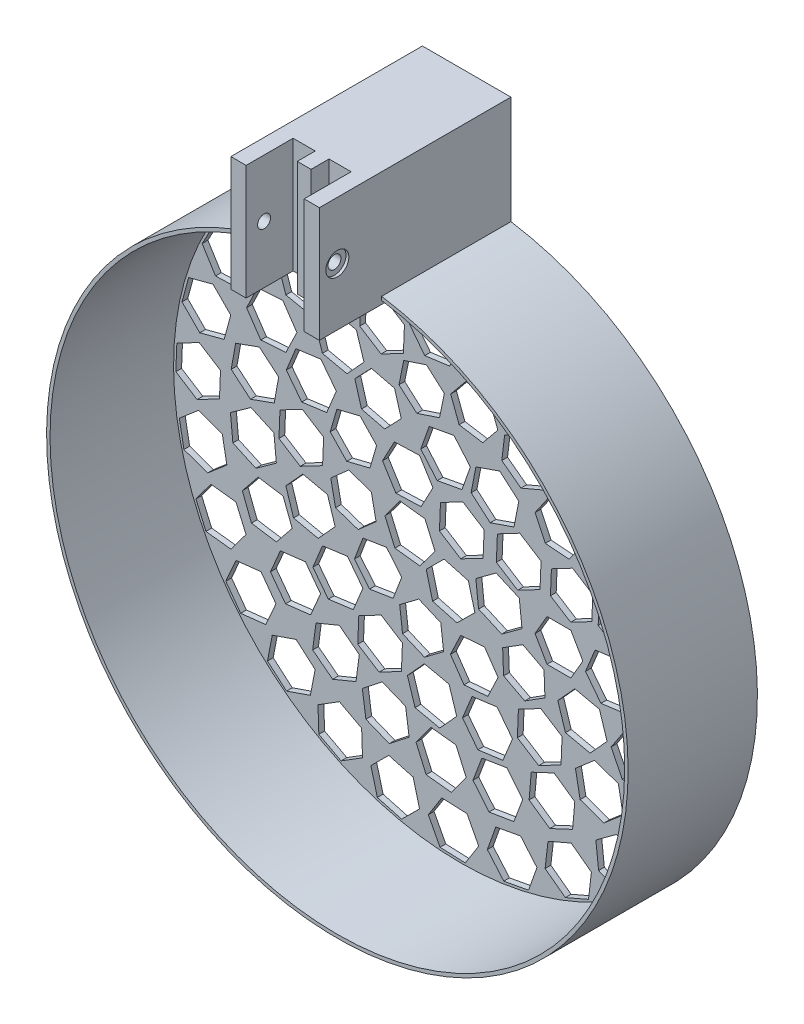
from build123d import *

# Parameters (mm, degrees)
BOSS_EXTRU_1_DEPTH                                = 20
CHAMBRAGE_POUR_VIS_SIX_PANS_CREUX_M41_D           = 4.5
CHAMBRAGE_POUR_VIS_SIX_PANS_CREUX_M41_DEPTH       = 11.55
CHAMBRAGE_POUR_VIS_SIX_PANS_CREUX_M41_CBORE_D     = 8
CHAMBRAGE_POUR_VIS_SIX_PANS_CREUX_M41_CBORE_DEPTH = 1
ESQUISSE6_W                                       = 20.2
ESQUISSE6_H                                       = 40
ENL_V_MAT_EXTRU_1_DEPTH                           = 3
ESQUISSE16_R                                      = 101.2
ESQUISSE16_R_2                                    = 100
EXTRU_MINCE1_DEPTH                                = 45
ESQUISSE14_W                                      = 30.8
ESQUISSE14_H                                      = 45
BOSS_EXTRU_3_DEPTH                                = 40
BOSS_EXTRU_4_START                                = -2
ESQUISSE17_R                                      = 100
BOSS_EXTRU_4_DEPTH                                = 2
ENL_V_MAT_EXTRU_2_DEPTH                           = 2


with BuildPart() as part:
    # Base → Boss.-Extru.1 (new, symmetric)
    with BuildSketch(Plane(origin=(0, 0, 0), x_dir=(1, 0, 0), z_dir=(0, 1, 0))):
        Polygon((-3.85, -2.4), (-3.85, 2.4), (-10.1, 2.4), (-10.1, 10.1), (-2.4, 10.1), (-2.4, 3.85), (2.4, 3.85), (2.4, 10.1), (10.1, 10.1), (10.1, 2.4), (3.85, 2.4), (3.85, -2.4), (10.1, -2.4), (10.1, -6.25), (15.4, -6.25), (15.4, 15.4), (-15.4, 15.4), (-15.4, -6.25), (-10.1, -6.25), (-10.1, -2.4), align=None)
    extrude(amount=BOSS_EXTRU_1_DEPTH, both=True)

    # Chambrage pour vis à six pans creux M41
    with Locations(Plane(origin=(15.4, 0, 0), x_dir=(0, 0, -1), z_dir=(1, 0, 0))):
        with Locations((0, 0)):
            chambrage_pour_vis_six_pans_creux_m41 = CounterBoreHole(CHAMBRAGE_POUR_VIS_SIX_PANS_CREUX_M41_D / 2, CHAMBRAGE_POUR_VIS_SIX_PANS_CREUX_M41_CBORE_D / 2, CHAMBRAGE_POUR_VIS_SIX_PANS_CREUX_M41_CBORE_DEPTH, depth=CHAMBRAGE_POUR_VIS_SIX_PANS_CREUX_M41_DEPTH)

    # Symétrie1: Chambrage pour vis à six pans creux M41 across plane
    add(chambrage_pour_vis_six_pans_creux_m41.mirror(Plane(origin=(0, 0, 0), x_dir=(0, 0, 1), z_dir=(1, 0, 0))), mode=Mode.SUBTRACT)

    # Esquisse6 → Enlèv. mat.-Extru.1 (cut, symmetric)
    with BuildSketch(Plane.XY):
        Rectangle(ESQUISSE6_W, ESQUISSE6_H)
    extrude(amount=ENL_V_MAT_EXTRU_1_DEPTH, both=True, mode=Mode.SUBTRACT)

    # Esquisse16 → Extru.-Mince1 (add)
    with BuildSketch(Plane(origin=(0, 0, -15.4), x_dir=(-1, 0, 0), z_dir=(0, 0, -1))):
        with Locations((0, -117.566500624)):
            Circle(ESQUISSE16_R)
        with Locations((0, -117.566500624)):
            Circle(ESQUISSE16_R_2, mode=Mode.SUBTRACT)
    extrude(amount=EXTRU_MINCE1_DEPTH)

    # Esquisse14 → Boss.-Extru.3 (add)
    with BuildSketch(Plane.XZ.offset(20)):
        with Locations((0, -37.9)):
            Rectangle(ESQUISSE14_W, ESQUISSE14_H)
    extrude(amount=-BOSS_EXTRU_3_DEPTH)

    # Esquisse17 → Boss.-Extru.4 (add)
    with BuildSketch(Plane(origin=(0, 0, -60.4), x_dir=(-1, 0, 0), z_dir=(0, 0, -1)).offset(BOSS_EXTRU_4_START)):
        with Locations((0, -117.566500624)):
            Circle(ESQUISSE17_R)
    extrude(amount=BOSS_EXTRU_4_DEPTH)

    # Esquisse18 → Enlèv. mat.-Extru.2 (cut)
    with BuildSketch(Plane(origin=(0, 0, -60.4), x_dir=(-1, 0, 0), z_dir=(0, 0, -1))):
        Polygon((-29.387612526, -106.502992287), (-25.826513123, -98.986886987), (-30.55510155, -92.144831789), (-38.844789378, -92.818881891), (-42.405888781, -100.334987191), (-37.677300355, -107.177042389), align=None)
        Polygon((-31.162907279, -121.427355014), (-31.502618651, -113.117248876), (-38.869237361, -109.256394486), (-45.896144698, -113.705646234), (-45.556433326, -122.015752371), (-38.189814616, -125.876606761), align=None)
        Polygon((-20.879969902, -94.11314599), (-14.233864682, -89.112890673), (-15.241160202, -80.857067057), (-22.894560942, -77.601498759), (-29.540666163, -82.601754076), (-28.533370643, -90.857577692), align=None)
        Polygon((-7.588977805, -87.096180597), (0.619590621, -85.757273496), (3.564347272, -77.978991159), (-1.699464504, -71.539615923), (-9.90803293, -72.878523024), (-12.852789581, -80.656805361), align=None)
        Polygon((7.44055765, -87.059598314), (15.33110518, -89.688766911), (21.553305741, -84.169936598), (19.884958772, -76.021937689), (11.994411242, -73.392769092), (5.772210681, -78.911599404), align=None)
        Polygon((20.765551016, -94.011779702), (26.530448302, -100.006713156), (34.604661611, -98.011632383), (36.913977633, -90.021618156), (31.149080346, -84.026684702), (23.074867038, -86.021765475), align=None)
        Polygon((29.333406896, -106.360063789), (31.651985445, -114.347395092), (39.728506536, -116.333112821), (45.486449079, -110.331499245), (43.167870531, -102.344167942), (35.09134944, -100.358450213), align=None)
        Polygon((31.181332763, -121.275607502), (29.52243417, -129.425535311), (35.751029395, -134.93714754), (43.638523213, -132.298831959), (45.297421806, -124.148904149), (39.068826581, -118.637291921), align=None)
        Polygon((25.885991069, -135.341439529), (20.62964901, -141.7869136), (23.583422266, -149.561776389), (31.79353758, -150.891165107), (37.049879639, -144.445691036), (34.096106383, -136.670828247), align=None)
        Polygon((14.660480781, -145.335247264), (7.010859877, -148.599687163), (6.013137307, -156.856673146), (12.665035641, -161.849219228), (20.314656545, -158.584779329), (21.312379115, -150.327793346), align=None)
        Polygon((0.076431024, -148.967569793), (-8.214032765, -148.303131681), (-12.934684943, -155.150664875), (-9.364873333, -162.662636182), (-1.074409544, -163.327074294), (3.646242634, -156.479541099), align=None)
        Polygon((-14.525128159, -145.4062858), (-21.557189489, -140.96518444), (-28.919326753, -144.834577513), (-29.249402686, -153.145071946), (-22.217341355, -157.586173305), (-14.855204092, -153.716780232), align=None)
        Polygon((-25.799155528, -135.467242528), (-29.961853894, -128.266880721), (-38.278899319, -128.271702352), (-42.433246376, -135.476885789), (-38.27054801, -142.677247595), (-29.953502586, -142.672425965), align=None)
        Polygon((-47.779097213, -122.041699254), (-48.137655018, -113.2705669), (-55.912957359, -109.195520891), (-63.329701895, -113.891607235), (-62.97114409, -122.662739589), (-55.195841749, -126.737785599), align=None)
        Polygon((-46.428273156, -105.430398077), (-43.765303334, -97.065595736), (-49.677949748, -90.57699505), (-58.253565984, -92.453196706), (-60.916535805, -100.817999046), (-55.003889392, -107.306599732), align=None)
        Polygon((-39.477514148, -90.282889976), (-34.114210162, -83.333336262), (-37.45104823, -75.213801905), (-46.151190284, -74.043821261), (-51.51449427, -80.993374975), (-48.177656202, -89.112909332), align=None)
        Polygon((-27.765184308, -78.426187982), (-20.348439771, -73.730101638), (-20.706997576, -64.958969284), (-28.482299917, -60.883923275), (-35.899044453, -65.580009619), (-35.540486648, -74.351141973), align=None)
        Polygon((-12.703963469, -71.290385343), (-4.128347234, -69.414183688), (-1.465377412, -61.049381347), (-7.378023826, -54.560780662), (-15.953640061, -56.436982317), (-18.616609883, -64.801784658), align=None)
        Polygon((3.889542854, -69.736165169), (12.589684908, -70.906145813), (17.952988895, -63.956592099), (14.616150827, -55.837057742), (5.916008772, -54.667077098), (0.552704786, -61.616630812), align=None)
        Polygon((20.013912905, -73.950989352), (27.789215246, -78.026035361), (35.205959782, -73.329949017), (34.847401978, -64.558816663), (27.072099637, -60.483770653), (19.655355101, -65.179856998), align=None)
        Polygon((33.724309687, -83.42648789), (39.636956101, -89.915088576), (48.212572336, -88.03888692), (50.875542158, -79.67408458), (44.962895744, -73.185483894), (36.387279508, -75.061685549), align=None)
        Polygon((43.367057002, -97.019775817), (46.70389507, -105.139310174), (55.404037124, -106.309290818), (60.76734111, -99.359737104), (57.430503043, -91.240202747), (48.730360988, -90.070222103), align=None)
        Polygon((47.779097213, -113.091301993), (48.137655018, -121.862434347), (55.912957359, -125.937480356), (63.329701895, -121.241394012), (62.97114409, -112.470261658), (55.195841749, -108.395215649), align=None)
        Polygon((46.428273156, -129.702603171), (43.765303334, -138.067405511), (49.677949748, -144.556006197), (58.253565984, -142.679804542), (60.916535805, -134.315002201), (55.003889392, -127.826401516), align=None)
        Polygon((39.477514148, -144.850111271), (34.114210162, -151.799664985), (37.45104823, -159.919199342), (46.151190284, -161.089179986), (51.51449427, -154.139626272), (48.177656202, -146.020091915), align=None)
        Polygon((27.765184308, -156.706813265), (20.348439771, -161.402899609), (20.706997576, -170.174031963), (28.482299917, -174.249077973), (35.899044453, -169.552991628), (35.540486648, -160.781859274), align=None)
        Polygon((12.703963469, -163.842615904), (4.128347234, -165.718817559), (1.465377412, -174.0836199), (7.378023826, -180.572220586), (15.953640061, -178.69601893), (18.616609883, -170.33121659), align=None)
        Polygon((-3.889542854, -165.396836078), (-12.589684908, -164.226855435), (-17.952988895, -171.176409148), (-14.616150827, -179.295943506), (-5.916008772, -180.465924149), (-0.552704786, -173.516370435), align=None)
        Polygon((-20.013912905, -161.182011895), (-27.789215246, -157.106965886), (-35.205959782, -161.80305223), (-34.847401978, -170.574184584), (-27.072099637, -174.649230594), (-19.655355101, -169.953144249), align=None)
        Polygon((-33.724309687, -151.706513357), (-39.636956101, -145.217912672), (-48.212572336, -147.094114327), (-50.875542158, -155.458916668), (-44.962895744, -161.947517353), (-36.387279508, -160.071315698), align=None)
        Polygon((-43.367057002, -138.11322543), (-46.70389507, -129.993691073), (-55.404037124, -128.823710429), (-60.76734111, -135.773264143), (-57.430503043, -143.8927985), (-48.730360988, -145.062779144), align=None)
        Polygon((-64.853002343, -123.592265661), (-65.211560148, -114.821133307), (-72.986862489, -110.746087297), (-80.403607025, -115.442173642), (-80.04504922, -124.213305996), (-72.269746879, -128.288352005), align=None)
        Polygon((-64.073809043, -105.871683316), (-62.052647364, -97.329070604), (-68.440186146, -91.307386889), (-76.848886609, -93.828315884), (-78.870048289, -102.370928596), (-72.482509506, -108.392612311), align=None)
        Polygon((-58.542554445, -89.01845207), (-54.291573596, -81.337925506), (-58.81761429, -73.816204818), (-67.594635833, -73.975010694), (-71.845616682, -81.655537257), (-67.319575988, -89.177257945), align=None)
        Polygon((-48.669466398, -74.282498986), (-42.503942183, -68.03368809), (-44.832809055, -59.569782043), (-53.327200143, -57.354686894), (-59.492724358, -63.60349779), (-57.163857486, -72.067403837), align=None)
        Polygon((-35.186786676, -62.756722293), (-27.56398782, -58.403072781), (-27.522959469, -49.624710568), (-35.104729973, -45.199997867), (-42.727528829, -49.553647379), (-42.768557181, -58.332009592), align=None)
        Polygon((-19.094463955, -55.295936121), (-10.579738578, -53.160338261), (-8.171857888, -44.718570849), (-14.278702576, -38.412401295), (-22.793427953, -40.547999155), (-25.201308643, -48.989766568), align=None)
        Polygon((-1.585992194, -52.453472849), (7.189161476, -52.694314165), (11.785313009, -45.215228823), (7.606310872, -37.495302165), (-1.168842798, -37.254460849), (-5.764994331, -44.733546191), align=None)
        Polygon((16.040105352, -54.440144975), (24.424874311, -57.039563368), (30.868421154, -51.077849642), (28.927199038, -42.516717523), (20.54243008, -39.917299129), (14.098883237, -45.879012855), align=None)
        Polygon((32.476581664, -61.108610115), (39.849105955, -65.873818615), (47.662159715, -61.871629539), (48.102689185, -53.104231963), (40.730164894, -48.339023463), (32.917111133, -52.341212539), align=None)
        Polygon((46.504418483, -71.964298717), (52.317911707, -78.541883608), (60.921013931, -76.796043237), (63.71062293, -68.472617975), (57.897129706, -61.895033083), (49.294027483, -63.640873454), align=None)
        Polygon((57.083235328, -86.202094018), (60.906537287, -94.10422592), (69.661635238, -94.744215247), (74.59343123, -87.482072673), (70.77012927, -79.579940771), (62.015031319, -78.939951444), align=None)
        Polygon((63.428449746, -102.766043874), (64.978003626, -111.406657813), (73.235771741, -114.385011759), (79.943985977, -108.722751765), (78.394432097, -100.082137826), (70.136663982, -97.103783881), align=None)
        Polygon((65.069466213, -120.4276759), (64.230348689, -129.165937069), (71.378346085, -134.261764745), (79.365461003, -130.619331253), (80.204578527, -121.881070084), (73.056581132, -116.785242408), align=None)
        Polygon((61.884578044, -137.877107645), (58.719022625, -146.064939187), (64.227115034, -152.900306367), (72.90076286, -151.547842006), (76.066318279, -143.360010463), (70.55822587, -136.524643283), align=None)
        Polygon((54.109993824, -153.820194581), (48.852775275, -160.850342488), (52.31245268, -168.918301259), (61.029348635, -169.956112122), (66.286567184, -162.925964215), (62.826889779, -154.858005445), align=None)
        Polygon((42.322318899, -167.074510887), (35.363341069, -172.425581249), (36.518015025, -181.127768016), (44.631666811, -184.47888442), (51.590644642, -179.127814058), (50.435970686, -170.425627291), align=None)
        Polygon((27.395791193, -176.657044555), (19.251169632, -179.932172964), (18.015203254, -188.623186344), (24.923858437, -194.039071316), (33.068479998, -190.763942908), (34.304446376, -182.072929527), align=None)
        Polygon((10.437442982, -181.857102901), (1.711227012, -182.813388065), (-1.823713728, -190.848655355), (3.367561501, -197.927637483), (12.093777472, -196.971352319), (15.628718212, -188.936085028), align=None)
        Polygon((-7.295002627, -182.289021386), (-15.955629487, -180.855540009), (-21.527374206, -187.639122193), (-18.438492065, -195.856185756), (-9.777865205, -197.289667133), (-4.206120486, -190.506084949), align=None)
        Polygon((-24.486411264, -177.920766592), (-32.439129939, -174.20383343), (-39.63444782, -179.232623251), (-38.877047026, -187.978346234), (-30.92432835, -191.695279397), (-23.729010469, -186.666489576), align=None)
        Polygon((-39.861774795, -169.076311994), (-46.516768523, -163.351594975), (-54.802015755, -166.252630096), (-56.432269259, -174.878382236), (-49.777275531, -180.603099255), (-41.492028299, -177.702064134), align=None)
        Polygon((-52.280772845, -156.411610328), (-57.144471186, -149.103685525), (-65.905168884, -149.661809443), (-69.802168242, -157.527858164), (-64.938469901, -164.835782967), (-56.177772203, -164.277659049), align=None)
        Polygon((-60.822345142, -140.86594458), (-63.534029839, -132.516807344), (-72.120437133, -130.690626561), (-77.99515973, -137.213583014), (-75.283475033, -145.562720249), (-66.697067739, -147.388901032), align=None)
        Polygon((-12.337737532, -120.757214125), (-12.696295337, -111.986081771), (-20.471597678, -107.911035761), (-27.888342214, -112.607122106), (-27.529784409, -121.37825446), (-19.754482069, -125.453300469), align=None)
        Polygon((-10.187053796, -109.909846327), (-3.553063519, -104.160802973), (-5.214885972, -95.541077189), (-13.510698702, -92.670394757), (-20.144688979, -98.419438111), (-18.482866526, -107.039163895), align=None)
        Polygon((-0.365310773, -104.828095382), (8.265697598, -106.430287933), (13.968741234, -99.7567117), (11.0407765, -91.480942914), (2.409768129, -89.878750363), (-3.293275507, -96.552326597), align=None)
        Polygon((9.731518713, -109.3386234), (13.860219834, -117.085568186), (22.633621381, -117.383480524), (27.278321807, -109.934448075), (23.149620686, -102.187503289), (14.376219139, -101.889590951), align=None)
        Polygon((12.500316121, -120.044910786), (9.017713839, -128.103000374), (14.254922987, -135.148067216), (22.974734417, -134.13504447), (26.4573367, -126.076954882), (21.220127552, -119.03188804), align=None)
        Polygon((5.85612053, -128.884904769), (-2.615314605, -131.186233344), (-4.858023165, -139.673375666), (1.370703412, -145.859189412), (9.842138547, -143.557860837), (12.084847107, -135.070718516), align=None)
        Polygon((-5.197853263, -129.201909577), (-12.278957809, -124.013529784), (-20.312778787, -127.551756311), (-21.26549522, -136.278362631), (-14.184390674, -141.466742424), (-6.150569696, -137.928515898), align=None)
        Polygon((-83.671214021, -124.21409221), (-84.029771826, -115.442959856), (-91.805074166, -111.367913847), (-99.221818703, -116.064000192), (-98.863260898, -124.835132545), (-91.087958557, -128.910178555), align=None)
        Polygon((7.471168655, -121.213464214), (7.112610851, -112.44233186), (-0.66269149, -108.367285851), (-8.079436026, -113.063372195), (-7.720878222, -121.834504549), (0.054424119, -125.909550559), align=None)
        Polygon((-83.052630284, -105.428826521), (-81.450437732, -96.79781815), (-88.124013966, -91.094774514), (-96.399782751, -94.022739248), (-98.001975303, -102.653747619), (-91.328399069, -108.356791255), align=None)
        Polygon((-78.269440866, -87.252194494), (-74.786838584, -79.194104906), (-80.024047731, -72.149038064), (-88.743859162, -73.16206081), (-92.226461445, -81.220150398), (-86.989252297, -88.26521724), align=None)
        Polygon((-69.561494859, -70.595648358), (-64.373115066, -63.514543812), (-67.911341592, -55.480722833), (-76.637947913, -54.5280064), (-81.826327706, -61.609110946), (-78.288101179, -69.642931925), align=None)
        Polygon((-57.365445036, -56.294416887), (-50.73145476, -50.545373534), (-52.393277213, -41.925647749), (-60.689089943, -39.054965318), (-67.323080219, -44.804008671), (-65.661257766, -53.423734456), align=None)
        Polygon((-42.292852262, -45.065623545), (-34.545907476, -40.936922424), (-34.247995139, -32.163520876), (-41.697027587, -27.518820451), (-49.443972374, -31.647521572), (-49.741884711, -40.420923119), align=None)
        Polygon((-25.099519276, -37.472326917), (-16.62808414, -35.170998342), (-14.385375581, -26.68385602), (-20.614102157, -20.498042274), (-29.085537293, -22.799370849), (-31.328245852, -31.28651317), align=None)
        Polygon((-6.647591587, -33.895286603), (2.123540767, -33.536728798), (6.198586777, -25.761426457), (1.502500432, -18.344681921), (-7.268631922, -18.703239726), (-11.343677931, -26.478542067), align=None)
        Polygon((12.137674102, -34.51387034), (20.768682473, -36.116062891), (26.47172611, -29.442486658), (23.543761376, -21.166717873), (14.912753005, -19.564525321), (9.209709368, -26.238101555), align=None)
        Polygon((30.31430613, -39.297059757), (38.372395718, -42.77966204), (45.41746256, -37.542452892), (44.404439814, -28.822641462), (36.346350226, -25.340039179), (29.301283384, -30.577248327), align=None)
        Polygon((46.970852266, -48.005005764), (54.051956812, -53.193385558), (62.08577779, -49.655159031), (63.038494223, -40.928552711), (55.957389677, -35.740172917), (47.923568699, -39.278399444), align=None)
        Polygon((61.272083737, -60.201055587), (67.02112709, -66.835045864), (75.640852875, -65.173223411), (78.511535306, -56.877410681), (72.762491953, -50.243420404), (64.142766168, -51.905242857), align=None)
        Polygon((72.500877079, -75.273648361), (76.6295782, -83.020593148), (85.402979747, -83.318505485), (90.047680173, -75.869473036), (85.918979052, -68.12252825), (77.145577505, -67.824615913), align=None)
        Polygon((80.094173707, -92.466981348), (82.395502282, -100.938416483), (90.882644603, -103.181125043), (97.06845835, -96.952398466), (94.767129775, -88.480963331), (86.279987453, -86.238254771), align=None)
        Polygon((83.671214021, -110.918909037), (84.029771826, -119.690041391), (91.805074166, -123.7650874), (99.221818703, -119.069001056), (98.863260898, -110.297868702), (91.087958557, -106.222822692), align=None)
        Polygon((83.052630284, -129.704174726), (81.450437732, -138.335183097), (88.124013966, -144.038226734), (96.399782751, -141.110262), (98.001975303, -132.479253629), (91.328399069, -126.776209992), align=None)
        Polygon((78.269440866, -147.880806753), (74.786838584, -155.938896341), (80.024047731, -162.983963184), (88.743859162, -161.970940438), (92.226461445, -153.91285085), (86.989252297, -146.867784007), align=None)
        Polygon((69.561494859, -164.53735289), (64.373115066, -171.618457435), (67.911341592, -179.652278414), (76.637947913, -180.604994847), (81.826327706, -173.523890301), (78.288101179, -165.490069322), align=None)
        Polygon((57.365445036, -178.83858436), (50.73145476, -184.587627714), (52.393277213, -193.207353498), (60.689089943, -196.07803593), (67.323080219, -190.328992576), (65.661257766, -181.709266792), align=None)
        Polygon((42.292852262, -190.067377702), (34.545907476, -194.196078824), (34.247995139, -202.969480371), (41.697027587, -207.614180797), (49.443972374, -203.485479675), (49.741884711, -194.712078128), align=None)
        Polygon((25.099519276, -197.66067433), (16.62808414, -199.962002905), (14.385375581, -208.449145227), (20.614102157, -214.634958974), (29.085537293, -212.333630398), (31.328245852, -203.846488077), align=None)
        Polygon((6.647591587, -201.237714645), (-2.123540767, -201.596272449), (-6.198586777, -209.37157479), (-1.502500432, -216.788319326), (7.268631922, -216.429761522), (11.343677931, -208.654459181), align=None)
        Polygon((-12.137674102, -200.619130907), (-20.768682473, -199.016938356), (-26.47172611, -205.69051459), (-23.543761376, -213.966283375), (-14.912753005, -215.568475926), (-9.209709368, -208.894899692), align=None)
        Polygon((-30.31430613, -195.83594149), (-38.372395718, -192.353339207), (-45.41746256, -197.590548355), (-44.404439814, -206.310359786), (-36.346350226, -209.792962068), (-29.301283384, -204.555752921), align=None)
        Polygon((-46.970852266, -187.127995483), (-54.051956812, -181.939615689), (-62.08577779, -185.477842216), (-63.038494223, -194.204448536), (-55.957389677, -199.39282833), (-47.923568699, -195.854601803), align=None)
        Polygon((-61.272083737, -174.93194566), (-67.02112709, -168.297955383), (-75.640852875, -169.959777836), (-78.511535306, -178.255590566), (-72.762491953, -184.889580843), (-64.142766168, -183.22775839), align=None)
        Polygon((-72.500877079, -159.859352886), (-76.6295782, -152.1124081), (-85.402979747, -151.814495762), (-90.047680173, -159.263528211), (-85.918979052, -167.010472997), (-77.145577505, -167.308385335), align=None)
        Polygon((-80.094173707, -142.6660199), (-82.395502282, -134.194584764), (-90.882644603, -131.951876204), (-97.06845835, -138.180602781), (-94.767129775, -146.652037917), (-86.279987453, -148.894746476), align=None)
    extrude(amount=-ENL_V_MAT_EXTRU_2_DEPTH, mode=Mode.SUBTRACT)


solid = part.part
